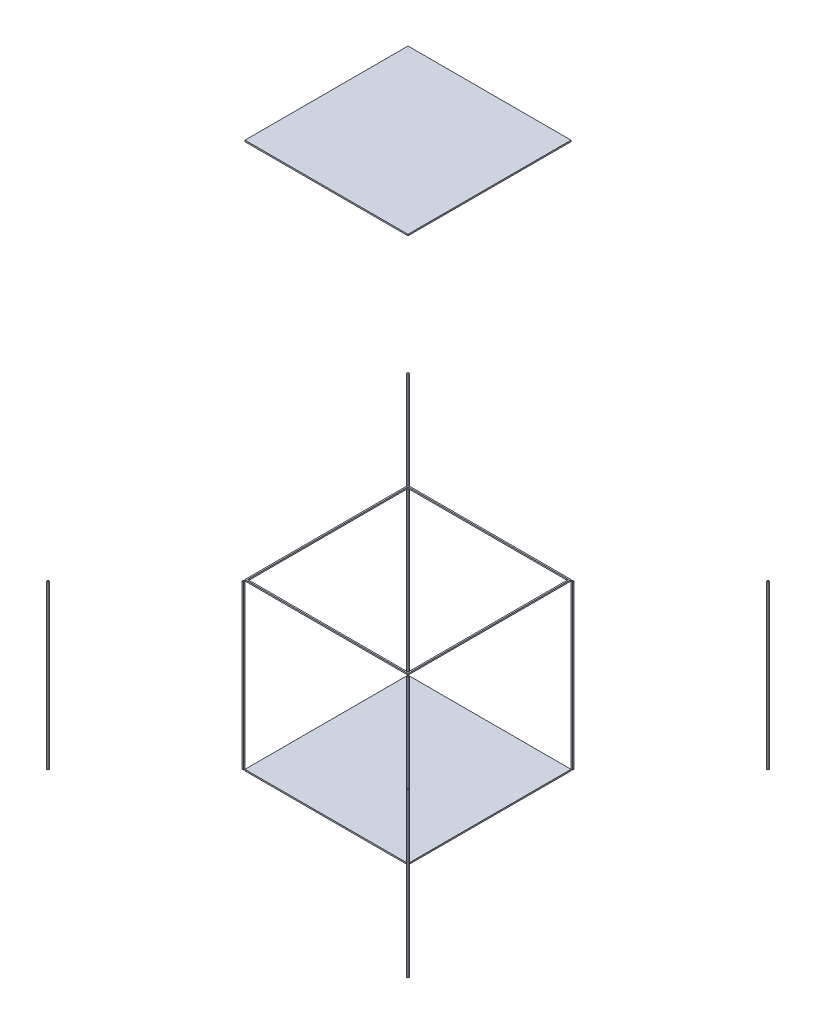
from build123d import *

# Parameters (mm, degrees)
SKETCH1_W             = 381
SKETCH1_H             = 381
BOSS_EXTRUDE1_DEPTH   = 3.175
SKETCH3_W             = 3.175
SKETCH3_H             = 3.175
BOSS_EXTRUDE2_DEPTH   = 381
BOSS_EXTRUDE2_2_DEPTH = 381
BOSS_EXTRUDE2_3_DEPTH = 381
BOSS_EXTRUDE2_4_DEPTH = 381
SKETCH4_W             = 381
SKETCH4_H             = 381
SKETCH4_W_2           = 374.65
SKETCH4_H_2           = 374.65
BOSS_EXTRUDE3_DEPTH   = 3.175
SKETCH5_W             = 3.175
SKETCH5_H             = 3.175
BOSS_EXTRUDE4_DEPTH   = 381
BOSS_EXTRUDE4_2_DEPTH = 381
BOSS_EXTRUDE4_3_DEPTH = 381
BOSS_EXTRUDE4_4_DEPTH = 381
SKETCH6_W             = 381
SKETCH6_H             = 381
BOSS_EXTRUDE5_DEPTH   = 3.175


with BuildPart() as part:
    # Sketch1 → Boss-Extrude1 (new body)
    with BuildSketch(Plane(origin=(0, 0, 0), x_dir=(1, 0, 0), z_dir=(0, 1, 0))):
        Rectangle(SKETCH1_W, SKETCH1_H)
    extrude(amount=BOSS_EXTRUDE1_DEPTH)


with BuildPart() as body_2:
    # Sketch3 → Boss-Extrude2 (new body)
    with BuildSketch(Plane(origin=(0, 3.175, 0), x_dir=(1, 0, 0), z_dir=(0, 1, 0))):
        with Locations((192.0875, 192.0875)):
            Rectangle(SKETCH3_W, SKETCH3_H)
    extrude(amount=BOSS_EXTRUDE2_DEPTH)


with BuildPart() as body_3:
    # Sketch3 → Boss-Extrude2 2 (new body)
    with BuildSketch(Plane(origin=(0, 3.175, 0), x_dir=(1, 0, 0), z_dir=(0, 1, 0))):
        with Locations((192.0875, -192.0875)):
            Rectangle(SKETCH3_W, SKETCH3_H)
    extrude(amount=BOSS_EXTRUDE2_2_DEPTH)


with BuildPart() as body_4:
    # Sketch3 → Boss-Extrude2 3 (new body)
    with BuildSketch(Plane(origin=(0, 3.175, 0), x_dir=(1, 0, 0), z_dir=(0, 1, 0))):
        with Locations((-192.0875, -192.0875)):
            Rectangle(SKETCH3_W, SKETCH3_H)
    extrude(amount=BOSS_EXTRUDE2_3_DEPTH)


with BuildPart() as body_5:
    # Sketch3 → Boss-Extrude2 4 (new body)
    with BuildSketch(Plane(origin=(0, 3.175, 0), x_dir=(1, 0, 0), z_dir=(0, 1, 0))):
        with Locations((-192.0875, 192.0875)):
            Rectangle(SKETCH3_W, SKETCH3_H)
    extrude(amount=BOSS_EXTRUDE2_4_DEPTH)


with BuildPart() as body_6:
    # Sketch4 → Boss-Extrude3 (new body)
    with BuildSketch(Plane(origin=(0, 384.175, 0), x_dir=(1, 0, 0), z_dir=(0, 1, 0))):
        Rectangle(SKETCH4_W, SKETCH4_H)
        Rectangle(SKETCH4_W_2, SKETCH4_H_2, mode=Mode.SUBTRACT)
    extrude(amount=BOSS_EXTRUDE3_DEPTH)


with BuildPart() as body_7:
    # Sketch5 → Boss-Extrude4 (new body)
    with BuildSketch(Plane(origin=(0, 3.175, 0), x_dir=(1, 0, 0), z_dir=(0, 1, 0))):
        with Locations((-420.6875, -420.6875)):
            Rectangle(SKETCH5_W, SKETCH5_H)
    extrude(amount=BOSS_EXTRUDE4_DEPTH)


with BuildPart() as body_8:
    # Sketch5 → Boss-Extrude4 2 (new body)
    with BuildSketch(Plane(origin=(0, 3.175, 0), x_dir=(1, 0, 0), z_dir=(0, 1, 0))):
        with Locations((-420.6875, 420.6875)):
            Rectangle(SKETCH5_W, SKETCH5_H)
    extrude(amount=BOSS_EXTRUDE4_2_DEPTH)


with BuildPart() as body_9:
    # Sketch5 → Boss-Extrude4 3 (new body)
    with BuildSketch(Plane(origin=(0, 3.175, 0), x_dir=(1, 0, 0), z_dir=(0, 1, 0))):
        with Locations((420.6875, 420.6875)):
            Rectangle(SKETCH5_W, SKETCH5_H)
    extrude(amount=BOSS_EXTRUDE4_3_DEPTH)


with BuildPart() as body_10:
    # Sketch5 → Boss-Extrude4 4 (new body)
    with BuildSketch(Plane(origin=(0, 3.175, 0), x_dir=(1, 0, 0), z_dir=(0, 1, 0))):
        with Locations((420.6875, -420.6875)):
            Rectangle(SKETCH5_W, SKETCH5_H)
    extrude(amount=BOSS_EXTRUDE4_4_DEPTH)


with BuildPart() as body_11:
    # Sketch6 → Boss-Extrude5 (new body)
    with BuildSketch(Plane(origin=(0, 1273.175, 0), x_dir=(1, 0, 0), z_dir=(0, 1, 0))):
        Rectangle(SKETCH6_W, SKETCH6_H)
    extrude(amount=BOSS_EXTRUDE5_DEPTH)


solid = Compound([part.part, body_2.part, body_3.part, body_4.part, body_5.part, body_6.part, body_7.part, body_8.part, body_9.part, body_10.part, body_11.part])
